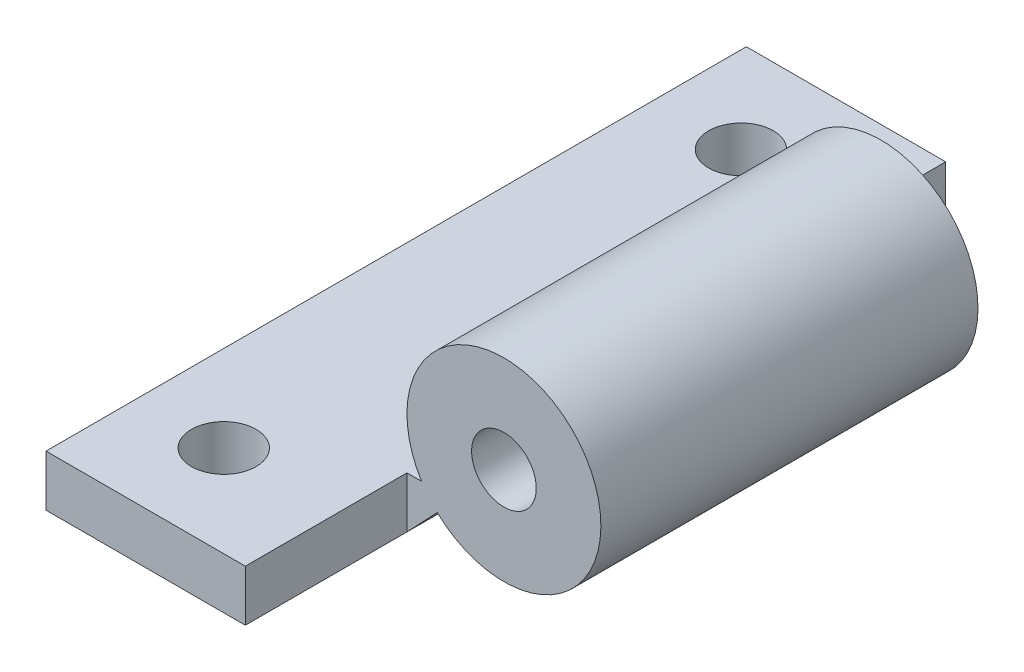
from build123d import *

# Parameters (mm, degrees)
EXTRUDE_1_DEPTH     = 65
SKETCH_2_R          = 3
CUT_EXTRUDE_1_DEPTH = 65
SKETCH_3_W          = 18
SKETCH_3_H          = 15
CUT_EXTRUDE_2_DEPTH = 25
SKETCH_4_R          = 3
CUT_EXTRUDE_3_DEPTH = 50


with BuildPart() as part:
    # 草图1 → 凸台-拉伸1 (new body)
    with BuildSketch(Plane.XY):
        with BuildLine():
            Line((-27.5, 4.75), (-27.5, 0))
            Line((-27.5, 0), (-9, 0))
            Line((-9, 0), (-6.189701831, 2.966425845))
            ThreePointArc((-6.189701831, 2.966425845), (6.974322263, 15.188482133), (-7.644442426, 4.75))
            Line((-7.644442426, 4.75), (-27.5, 4.75))
        make_face()
    extrude(amount=EXTRUDE_1_DEPTH)

    # 草图2 → 切除-拉伸1 (cut)
    with BuildSketch(Plane(origin=(0, 4.75, 0), x_dir=(1, 0, 0), z_dir=(0, 1, 0))):
        with Locations(Location((-19.5, -8.5, 0), (0, 0, 180))):
            Circle(SKETCH_2_R)
        with Locations(Location((-19.5, -56.5, 0), (0, 0, 270))):
            Circle(SKETCH_2_R)
    extrude(amount=-CUT_EXTRUDE_1_DEPTH, mode=Mode.SUBTRACT)

    # 草图3 → 切除-拉伸2 (cut, symmetric)
    with BuildSketch(Plane(origin=(0, 4.75, 0), x_dir=(1, 0, 0), z_dir=(0, 1, 0))):
        with Locations((0, -7.5)):
            Rectangle(SKETCH_3_W, SKETCH_3_H)
        with Locations((0, -57.5)):
            Rectangle(SKETCH_3_W, SKETCH_3_H)
    extrude(amount=CUT_EXTRUDE_2_DEPTH, both=True, mode=Mode.SUBTRACT)

    # 草图4 → 切除-拉伸3 (cut)
    with BuildSketch(Plane.XY.offset(50)):
        with Locations((0, 9.5)):
            Circle(SKETCH_4_R)
    extrude(amount=-CUT_EXTRUDE_3_DEPTH, mode=Mode.SUBTRACT)


solid = part.part
